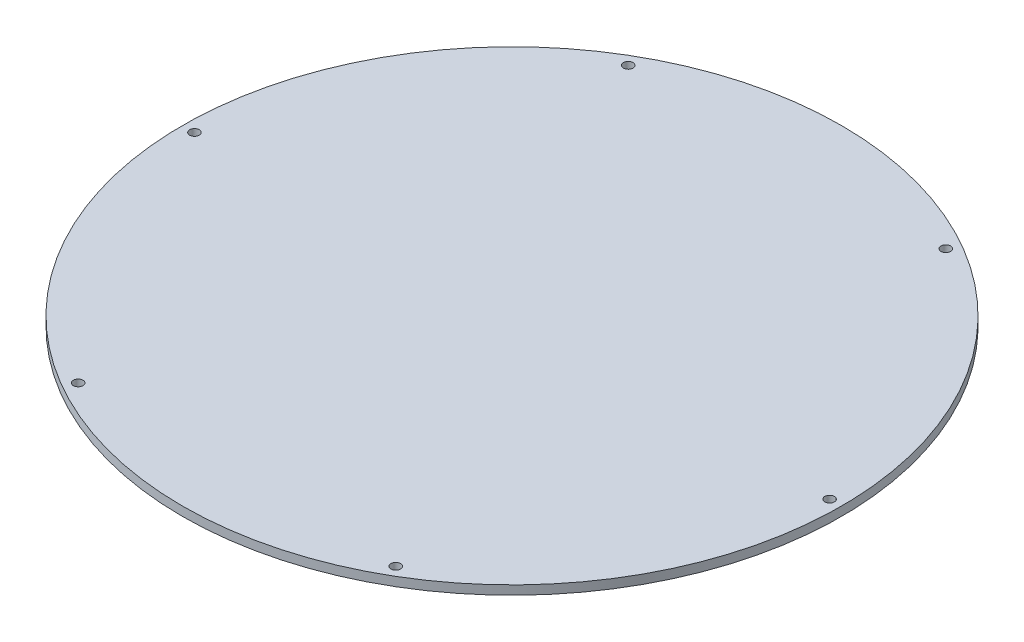
from build123d import *

# Parameters (mm, degrees)
SKETCH1_R           = 110
BOSS_EXTRUDE1_DEPTH = 3
SKETCH2_R           = 1.6
CUT_EXTRUDE1_DEPTH  = 3


with BuildPart() as part:
    # Sketch1 → Boss-Extrude1 (new body)
    with BuildSketch(Plane(origin=(0, 0, 0), x_dir=(1, 0, 0), z_dir=(0, 1, 0))):
        with Locations(Location((0, 0, 0), (0, 0, 270))):
            Circle(SKETCH1_R)
    extrude(amount=BOSS_EXTRUDE1_DEPTH)

    # Sketch2 → Cut-Extrude1 (cut)
    with BuildSketch(Plane(origin=(0, 3, 0), x_dir=(1, 0, 0), z_dir=(0, 1, 0))):
        with Locations(Location((53, 91.798692801, 0), (0, 0, 270))):
            Circle(SKETCH2_R)
        with Locations(Location((106, 0, 0), (0, 0, 270))):
            Circle(SKETCH2_R)
        with Locations(Location((53, -91.798692801, 0), (0, 0, 270))):
            Circle(SKETCH2_R)
        with Locations(Location((-53, -91.798692801, 0), (0, 0, 270))):
            Circle(SKETCH2_R)
        with Locations(Location((-106, 0, 0), (0, 0, 270))):
            Circle(SKETCH2_R)
        with Locations(Location((-53, 91.798692801, 0), (0, 0, 270))):
            Circle(SKETCH2_R)
    extrude(amount=-CUT_EXTRUDE1_DEPTH, mode=Mode.SUBTRACT)


solid = part.part
